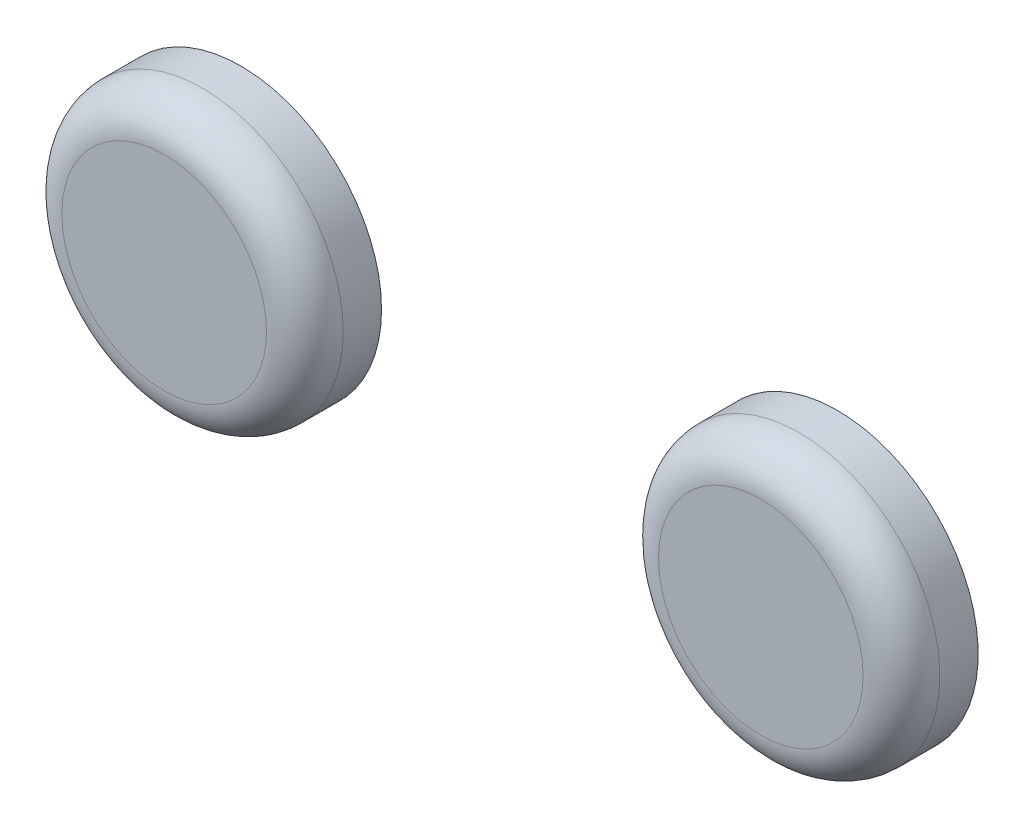
from build123d import *

# Parameters (mm, degrees)
SKETCH1_R             = 33
BOSS_EXTRUDE1_DEPTH   = 18
BOSS_EXTRUDE1_2_DEPTH = 18
FILLET1_R             = 9
FILLET2_R             = 9


with BuildPart() as part:
    # Sketch1 → Boss-Extrude1 (new body)
    with BuildSketch(Plane.XY):
        with Locations((-70, 0)):
            Circle(SKETCH1_R)
    extrude(amount=BOSS_EXTRUDE1_DEPTH)

    # Fillet1
    fillet1_edges = [part.edges().sort_by_distance(p)[0] for p in [
        (-103, 0, 18),
    ]]
    fillet(fillet1_edges, radius=FILLET1_R)


with BuildPart() as body_2:
    # Sketch1 → Boss-Extrude1 2 (new body)
    with BuildSketch(Plane.XY):
        with Locations(Location((70, 0, 0), (0, 0, 180))):
            Circle(SKETCH1_R)
    extrude(amount=BOSS_EXTRUDE1_2_DEPTH)

    # Fillet2
    fillet2_edges = [body_2.edges().sort_by_distance(p)[0] for p in [
        (103, 0, 18),
    ]]
    fillet(fillet2_edges, radius=FILLET2_R)


solid = Compound([part.part, body_2.part])
